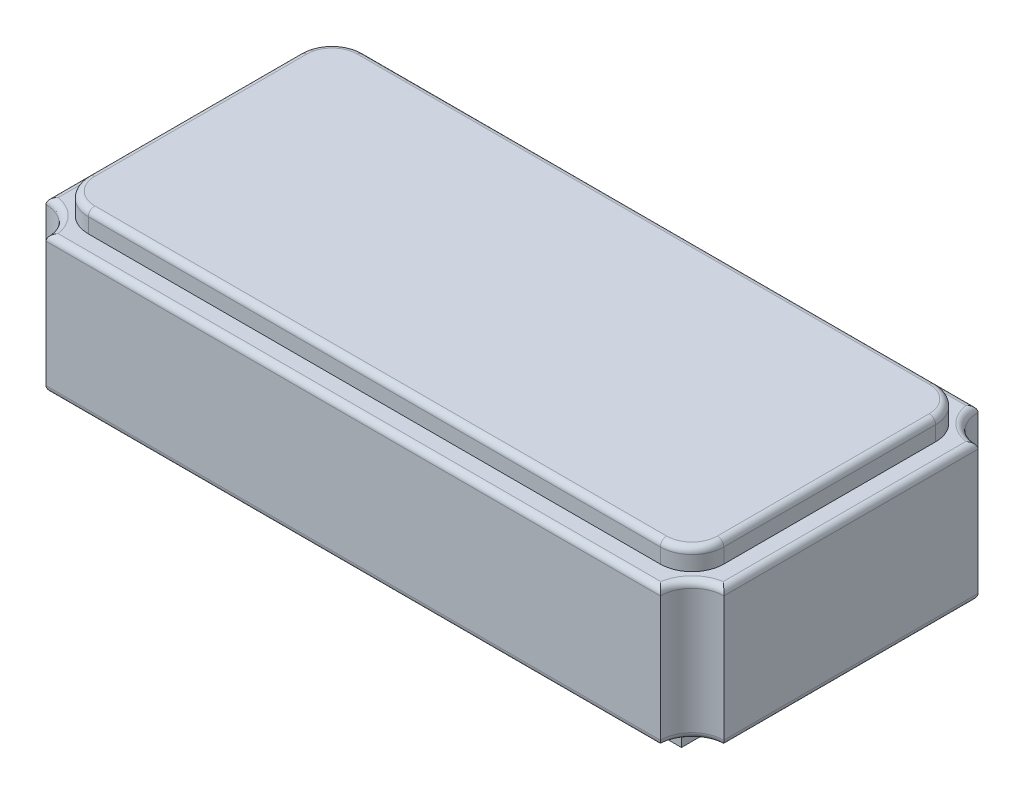
from build123d import *

# Parameters (mm, degrees)
EXTRUDE_START     = 0.05
EXTRUDE_1_DEPTH   = 0.65
EXTRUDE_2_DEPTH   = 0.1
FILLET_1_R        = 0.03
FILLET_2_R        = 0.03
FILLET_3_R        = 0.03
EXTRUDE_3_DEPTH   = 0.05
SKETCH_3_W        = 0.7
SKETCH_3_H        = 1.3
EXTRUDE_3_2_DEPTH = 0.05


with BuildPart() as part:
    # Эскиз1 → Бобышка-Вытянуть1 (new body)
    with BuildSketch(Plane(origin=(0, 0, 0), x_dir=(1, 0, 0), z_dir=(0, 1, 0)).offset(EXTRUDE_START)):
        with BuildLine():
            Line((-1.45, 0.75), (1.45, 0.75))
            ThreePointArc((1.45, 0.75), (1.493933983, 0.643933983), (1.6, 0.6))
            Line((1.6, 0.6), (1.6, -0.6))
            ThreePointArc((1.6, -0.6), (1.493933983, -0.643933983), (1.45, -0.75))
            Line((1.45, -0.75), (-1.45, -0.75))
            ThreePointArc((-1.45, -0.75), (-1.493933983, -0.643933983), (-1.6, -0.6))
            Line((-1.6, -0.6), (-1.6, 0.6))
            ThreePointArc((-1.6, 0.6), (-1.493933983, 0.643933983), (-1.45, 0.75))
        make_face()
    extrude(amount=EXTRUDE_1_DEPTH)

    # Скругление1
    fillet_1_edges = [part.edges().sort_by_distance(p)[0] for p in [
        (-1.493933983, 0.7, 0.643933983),
        (0, 0.7, 0.75),
        (1.493933983, 0.7, 0.643933983),
        (1.6, 0.7, 0),
        (1.493933983, 0.7, -0.643933983),
        (0, 0.7, -0.75),
        (-1.493933983, 0.7, -0.643933983),
        (-1.6, 0.7, 0),
    ]]
    fillet(fillet_1_edges, radius=FILLET_1_R)

    # Скругление2
    fillet_2_edges = [part.edges().sort_by_distance(p)[0] for p in [
        (-1.6, 0.05, 0),
        (-1.493933983, 0.05, -0.643933983),
        (0, 0.05, -0.75),
        (1.493933983, 0.05, -0.643933983),
        (1.6, 0.05, 0),
        (1.493933983, 0.05, 0.643933983),
        (0, 0.05, 0.75),
        (-1.493933983, 0.05, 0.643933983),
    ]]
    fillet(fillet_2_edges, radius=FILLET_2_R)


with BuildPart() as body_2:
    # Эскиз2 → Бобышка-Вытянуть2 (new body)
    with BuildSketch(Plane(origin=(0, 0.7, 0), x_dir=(1, 0, 0), z_dir=(0, 1, 0))):
        with BuildLine():
            Line((-1.35, -0.65), (1.35, -0.65))
            ThreePointArc((1.35, -0.65), (1.456066017, -0.606066017), (1.5, -0.5))
            Line((1.5, -0.5), (1.5, 0.5))
            ThreePointArc((1.5, 0.5), (1.456066017, 0.606066017), (1.35, 0.65))
            Line((1.35, 0.65), (-1.35, 0.65))
            ThreePointArc((-1.35, 0.65), (-1.456066017, 0.606066017), (-1.5, 0.5))
            Line((-1.5, 0.5), (-1.5, -0.5))
            ThreePointArc((-1.5, -0.5), (-1.456066017, -0.606066017), (-1.35, -0.65))
        make_face()
    extrude(amount=EXTRUDE_2_DEPTH)

    # Скругление3
    fillet_3_edges = [body_2.edges().sort_by_distance(p)[0] for p in [
        (-1.456066017, 0.8, -0.606066017),
        (-1.5, 0.8, 0),
        (-1.456066017, 0.8, 0.606066017),
        (0, 0.8, 0.65),
        (1.456066017, 0.8, 0.606066017),
        (1.5, 0.8, 0),
        (1.456066017, 0.8, -0.606066017),
        (0, 0.8, -0.65),
    ]]
    fillet(fillet_3_edges, radius=FILLET_3_R)


with BuildPart() as body_3:
    # Эскиз3 → Бобышка-Вытянуть3 (new body)
    with BuildSketch(Plane(origin=(0, 0, 0), x_dir=(1, 0, 0), z_dir=(0, 1, 0))):
        Polygon((-1.45, -0.65), (-0.75, -0.65), (-0.75, 0.25), (-1.15, 0.65), (-1.45, 0.65), align=None)
    extrude(amount=EXTRUDE_3_DEPTH)


with BuildPart() as body_4:
    # Эскиз3 → Extrude 3 2 (new body)
    with BuildSketch(Plane(origin=(0, 0, 0), x_dir=(1, 0, 0), z_dir=(0, 1, 0))):
        with Locations((1.1, 0)):
            Rectangle(SKETCH_3_W, SKETCH_3_H)
    extrude(amount=EXTRUDE_3_2_DEPTH)


solid = Compound([part.part, body_2.part, body_3.part, body_4.part])
